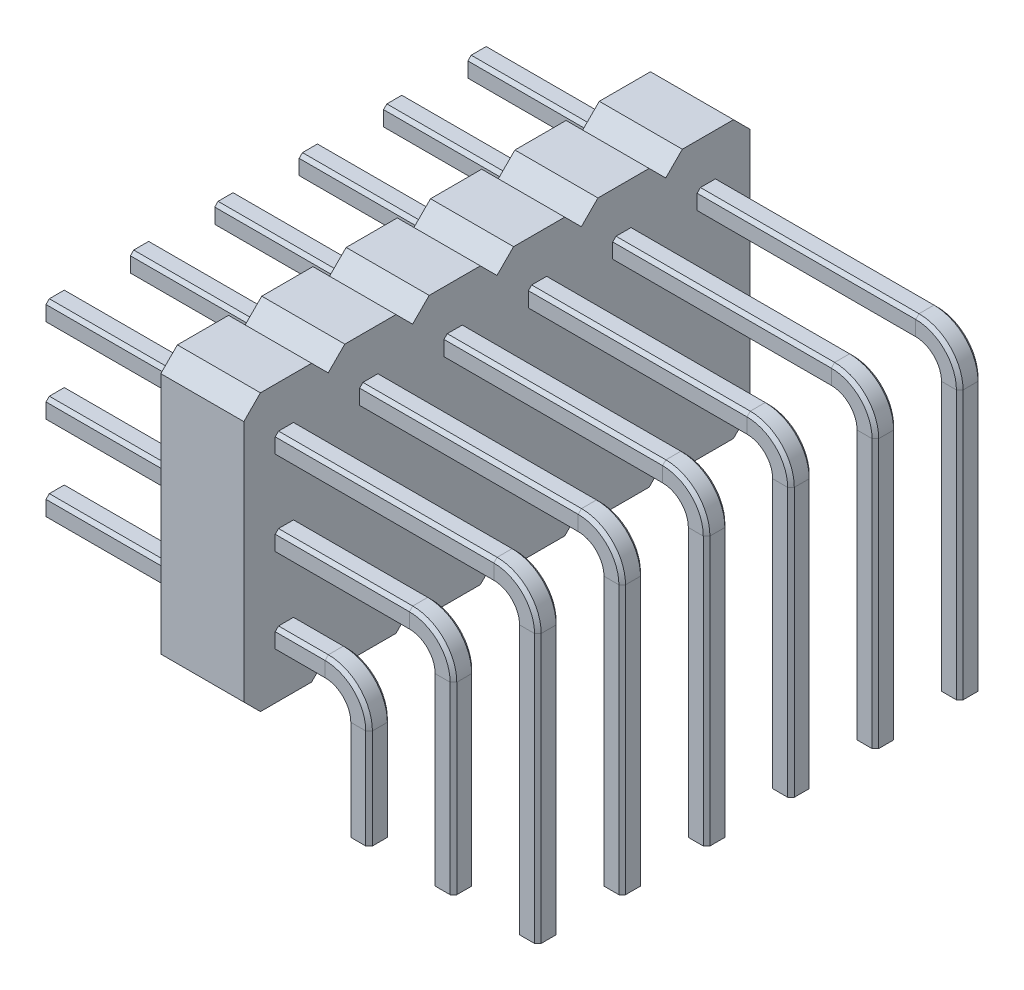
from build123d import *

# Parameters (mm, degrees)
BOSS_EXTRUDE1_DEPTH = 2.5
LPATTERN1_COUNT     = 6
LPATTERN1_PITCH     = 2.54


with BuildPart() as part:
    # Sweep3: sweep along a path in Sketch5
    with BuildLine(Plane.XY) as sweep3_path:
        Line((0, 0), (0, 3))
        ThreePointArc((0, 3), (-0.292893219, 3.707106781), (-1, 4))
        Line((-1, 4), (-9.4, 4))
    # Sketch1 → Sweep3 (sweep)
    with BuildSketch(Plane(origin=(0, 0, 0), x_dir=(1, 0, 0), z_dir=(0, 1, 0))):
        Polygon((-0.225, 0.325), (-0.325, 0.225), (-0.325, -0.225), (-0.225, -0.325), (0.225, -0.325), (0.325, -0.225), (0.325, 0.225), (0.225, 0.325), align=None)
    sweep(path=sweep3_path.line)



with BuildPart() as body_2:
    # Sweep4: sweep along a path in Sketch5<4>
    with BuildLine(Plane.XY) as sweep4_path:
        Line((2.54, 0), (2.54, 5.54))
        ThreePointArc((2.54, 5.54), (2.247106781, 6.247106781), (1.54, 6.54))
        Line((1.54, 6.54), (-9.4, 6.54))
    # Sketch1<4> → Sweep4 (sweep)
    with BuildSketch(Plane(origin=(0, 0, 0), x_dir=(1, 0, 0), z_dir=(0, 1, 0))):
        Polygon((2.765, 0.325), (2.315, 0.325), (2.215, 0.225), (2.215, -0.225), (2.315, -0.325), (2.765, -0.325), (2.865, -0.225), (2.865, 0.225), align=None)
    sweep(path=sweep4_path.line)


with BuildPart() as body_3:
    # Sweep5: sweep along a path in Sketch5<5>
    with BuildLine(Plane.XY) as sweep5_path:
        Line((5.08, 0), (5.08, 8.08))
        ThreePointArc((5.08, 8.08), (4.787106781, 8.787106781), (4.08, 9.08))
        Line((4.08, 9.08), (-9.4, 9.08))
    # Sketch1<5> → Sweep5 (sweep)
    with BuildSketch(Plane(origin=(0, 0, 0), x_dir=(1, 0, 0), z_dir=(0, 1, 0))):
        Polygon((5.305, 0.325), (4.855, 0.325), (4.755, 0.225), (4.755, -0.225), (4.855, -0.325), (5.305, -0.325), (5.405, -0.225), (5.405, 0.225), align=None)
    sweep(path=sweep5_path.line)


with BuildPart() as part_1:
    add(part.part)

    add(body_2.part)  # Boss-Extrude1 merges body 2

    add(body_3.part)  # Boss-Extrude1 merges body 3
    # Sketch6 → Boss-Extrude1 (add)
    with BuildSketch(Plane(origin=(-2.5, 0, 0), x_dir=(0, 0, -1), z_dir=(1, 0, 0))):
        Polygon((0.77, 2.363949738), (-0.77, 2.363949738), (-1.27, 2.863949738), (-1.27, 10.175), (-0.77, 10.675), (0.77, 10.675), (1.27, 10.175), (1.27, 2.863949738), align=None)
    extrude(amount=-BOSS_EXTRUDE1_DEPTH)


with BuildPart() as lpattern1_1:
    # LPattern1: pattern copy
    add(part_1.part.moved(Location(Vector(0, 0, 1) * (1 * LPATTERN1_PITCH))))


with BuildPart() as lpattern1_2:
    # LPattern1: pattern copy
    add(part_1.part.moved(Location(Vector(0, 0, 1) * (2 * LPATTERN1_PITCH))))


with BuildPart() as lpattern1_3:
    # LPattern1: pattern copy
    add(part_1.part.moved(Location(Vector(0, 0, 1) * (3 * LPATTERN1_PITCH))))


with BuildPart() as lpattern1_4:
    # LPattern1: pattern copy
    add(part_1.part.moved(Location(Vector(0, 0, 1) * (4 * LPATTERN1_PITCH))))


with BuildPart() as lpattern1_5:
    # LPattern1: pattern copy
    add(part_1.part.moved(Location(Vector(0, 0, 1) * (5 * LPATTERN1_PITCH))))


with BuildPart() as part_2:
    add(part_1.part)

    # Combine1: union LPattern1_1, LPattern1_2, LPattern1_3, LPattern1_4, LPattern1_5
    add(lpattern1_1.part)
    add(lpattern1_2.part)
    add(lpattern1_3.part)
    add(lpattern1_4.part)
    add(lpattern1_5.part)


solid = part_2.part
